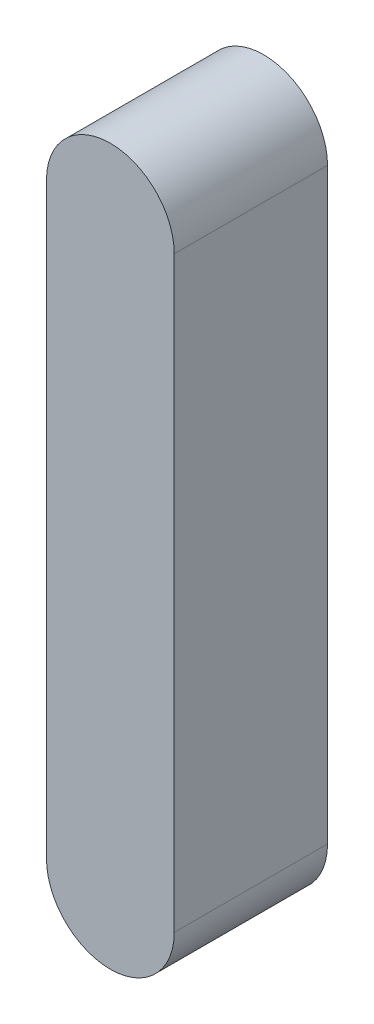
from build123d import *

# Parameters (mm, degrees)
EXTRUDE_1_DEPTH = 15


with BuildPart() as part:
    # 草图1 → 凸台-拉伸1 (new, symmetric)
    with BuildSketch(Plane.XY):
        with BuildLine():
            Line((-12.5, 0), (-12.5, 115))
            ThreePointArc((-12.5, 115), (0, 127.5), (12.5, 115))
            Line((12.5, 115), (12.5, 0))
            ThreePointArc((12.5, 0), (0, -12.5), (-12.5, 0))
        make_face()
    extrude(amount=EXTRUDE_1_DEPTH, both=True)


solid = part.part
